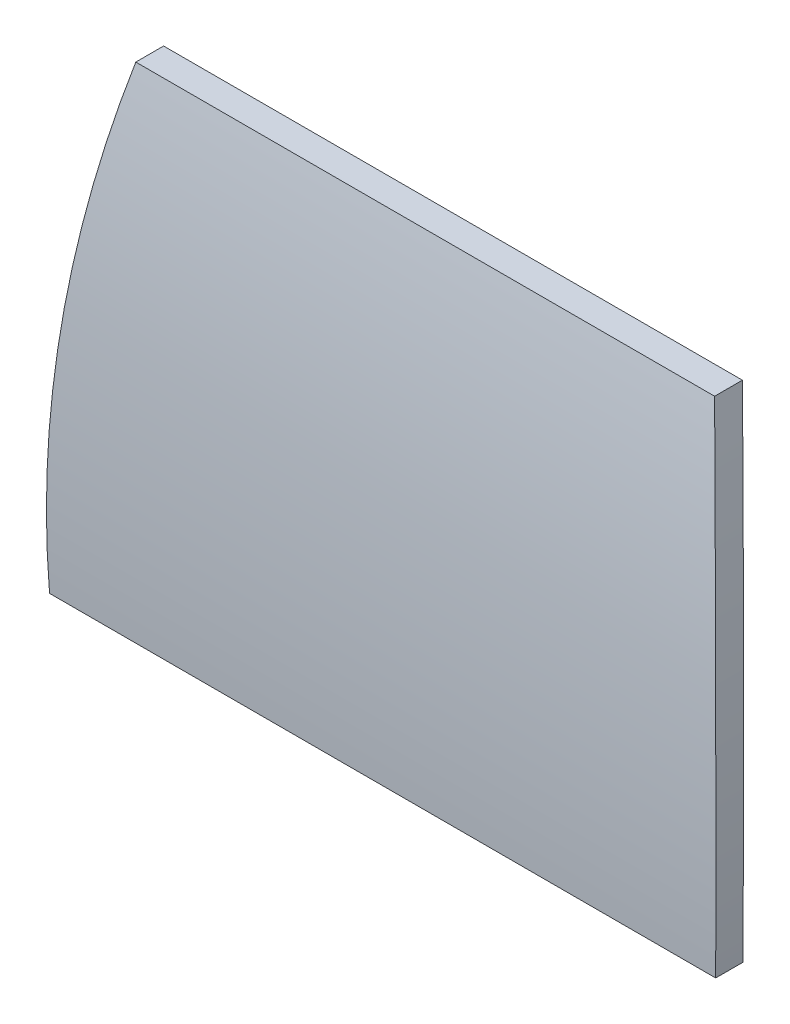
from build123d import *

# Parameters (mm, degrees)
BOSS_EXTRUDE2_DEPTH      = 254
BOSS_EXTRUDE2_DEPTH_BACK = 254
CUT_EXTRUDE1_DEPTH       = 2294.662552242
CUT_EXTRUDE1_DEPTH_BACK  = 1778


with BuildPart() as part:
    # Sketch3 → Boss-Extrude2 (new, two sides: drawn at the far end of the back side and taken through both)
    with BuildSketch(Plane.XY.offset(-BOSS_EXTRUDE2_DEPTH_BACK)):
        with BuildLine():
            Line((124.179493225, 1295.4), (1749.779493225, 1295.4))
            ThreePointArc((1749.779493225, 1295.4), (1855.177790652, 651.891599774), (1870.964, 0))
            Line((1870.964, 0), (0, 0))
            ThreePointArc((0, 0), (17.273884389, 651.996133287), (124.179493225, 1295.4))
        make_face()
    extrude(amount=BOSS_EXTRUDE2_DEPTH + BOSS_EXTRUDE2_DEPTH_BACK)

    # Sketch5 → Cut-Extrude1 (cut, two sides: drawn at the far end of the back side and taken through both)
    with BuildSketch(Plane(origin=(0, 0, 0), x_dir=(0, 0, -1), z_dir=(1, 0, 0)).offset(-CUT_EXTRUDE1_DEPTH_BACK)):
        with BuildLine():
            Line((196.186778864, 1295.4), (254, 1295.4))
            Line((254, 1295.4), (254, 0))
            Line((254, 0), (76.26716522, 0))
            ThreePointArc((76.26716522, 0), (93.965970842, 651.612245589), (196.186778864, 1295.4))
        make_face()
        with BuildLine():
            ThreePointArc((118.0703125, 1295.4), (15.664285855, 651.653074125), (0, 0))
            Line((0, 0), (-254, 0))
            Line((-254, 0), (-254, 1295.4))
            Line((-254, 1295.4), (118.0703125, 1295.4))
        make_face()
    extrude(amount=CUT_EXTRUDE1_DEPTH + CUT_EXTRUDE1_DEPTH_BACK, mode=Mode.SUBTRACT)


solid = part.part
